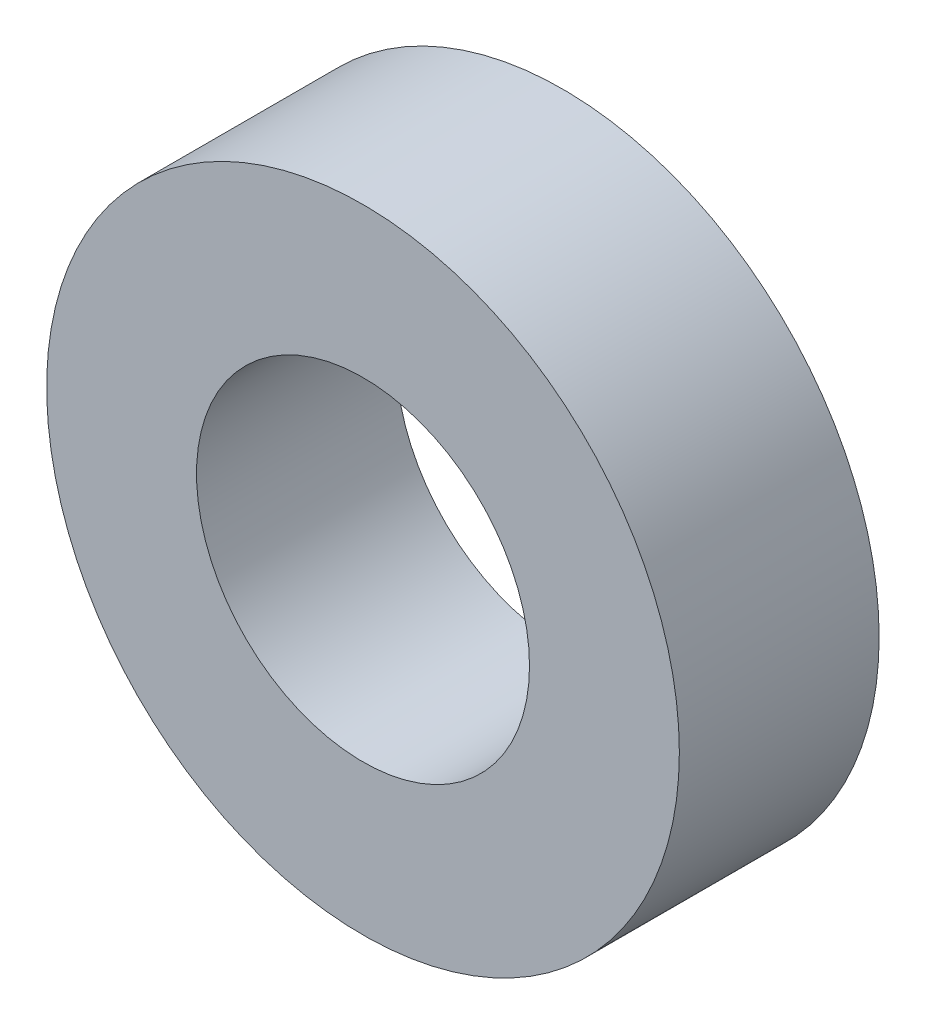
from build123d import *

# Parameters (mm, degrees)
SKETCH_1_R      = 9.5
SKETCH_1_R_2    = 5
EXTRUDE_1_DEPTH = 3


with BuildPart() as part:
    # ｽｹｯﾁ1 → 押し出し-薄板1 (new, symmetric)
    with BuildSketch(Plane.XY):
        Circle(SKETCH_1_R)
        Circle(SKETCH_1_R_2, mode=Mode.SUBTRACT)
    extrude(amount=EXTRUDE_1_DEPTH, both=True)


solid = part.part
